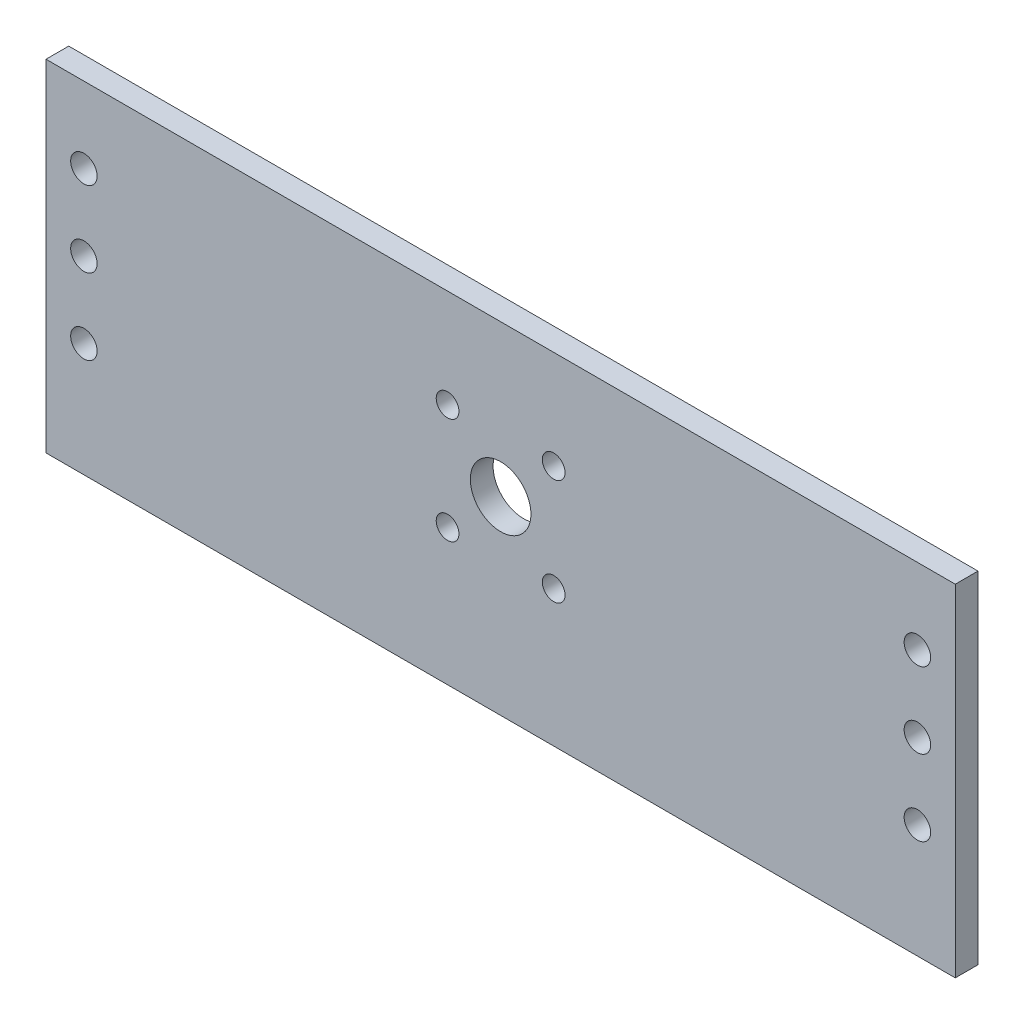
from build123d import *

# Parameters (mm, degrees)
ESQUISSE1_W             = 120
ESQUISSE1_H             = 45
BOSS_EXTRU_1_DEPTH      = 3
ESQUISSE2_R             = 1.747592995
ESQUISSE2_R_2           = 4
ESQUISSE2_R_3           = 1.5
ENL_V_MAT_EXTRU_1_DEPTH = 10


with BuildPart() as part:
    # Esquisse1 → Boss.-Extru.1 (new body)
    with BuildSketch(Plane.XY):
        Rectangle(ESQUISSE1_W, ESQUISSE1_H)
    extrude(amount=BOSS_EXTRU_1_DEPTH)

    # Esquisse2 → Enlèv. mat.-Extru.1 (cut)
    with BuildSketch(Plane.XY.offset(3)):
        with Locations((-55, 12.5)):
            Circle(ESQUISSE2_R)
        with Locations((55, 12.5)):
            Circle(ESQUISSE2_R)
        with Locations((-55, 2.5)):
            Circle(ESQUISSE2_R)
        with Locations((-55, -7.5)):
            Circle(ESQUISSE2_R)
        with Locations((55, -7.5)):
            Circle(ESQUISSE2_R)
        with Locations((55, 2.5)):
            Circle(ESQUISSE2_R)
        with Locations((0, 2.5)):
            Circle(ESQUISSE2_R_2)
        with Locations((-7, 9.5)):
            Circle(ESQUISSE2_R_3)
        with Locations((7, 9.5)):
            Circle(ESQUISSE2_R_3)
        with Locations((7, -4.5)):
            Circle(ESQUISSE2_R_3)
        with Locations((-7, -4.5)):
            Circle(ESQUISSE2_R_3)
    extrude(amount=-ENL_V_MAT_EXTRU_1_DEPTH, mode=Mode.SUBTRACT)


solid = part.part
